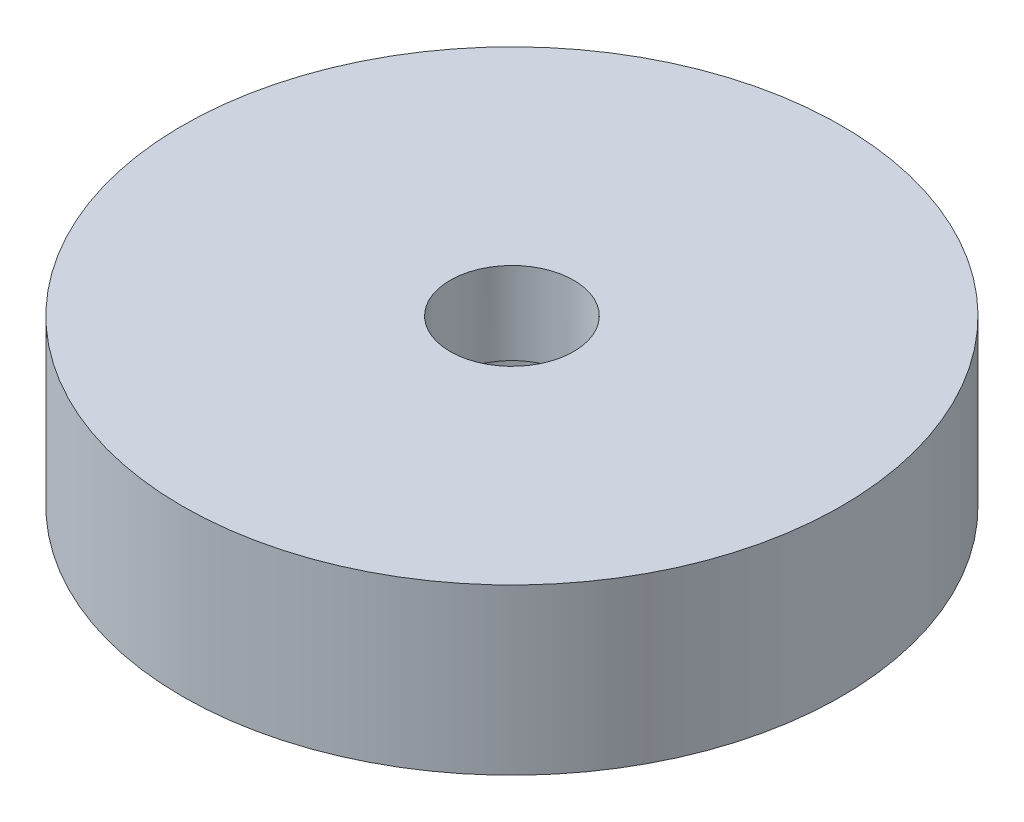
from build123d import *

# Parameters (mm, degrees)
SKETCH1_R           = 25.4
BOSS_EXTRUDE1_DEPTH = 12.7
SKETCH2_R           = 4.7625
CUT_EXTRUDE1_DEPTH  = 12.7
SKETCH4_R           = 9.525
CUT_EXTRUDE3_DEPTH  = 6.35


with BuildPart() as part:
    # Sketch1 → Boss-Extrude1 (new body)
    with BuildSketch(Plane(origin=(0, 0, 0), x_dir=(1, 0, 0), z_dir=(0, 1, 0))):
        with Locations(Location((0, 0, 0), (0, 0, 270))):
            Circle(SKETCH1_R)
    extrude(amount=BOSS_EXTRUDE1_DEPTH)

    # Sketch2 → Cut-Extrude1 (cut)
    with BuildSketch(Plane(origin=(0, 12.7, 0), x_dir=(1, 0, 0), z_dir=(0, 1, 0))):
        with Locations(Location((0, 0, 0), (0, 0, 270))):
            Circle(SKETCH2_R)
    extrude(amount=-CUT_EXTRUDE1_DEPTH, mode=Mode.SUBTRACT)

    # Sketch4 → Cut-Extrude3 (cut)
    with BuildSketch(Plane(origin=(0, 0, 0), x_dir=(-1, 0, 0), z_dir=(0, -1, 0))):
        with Locations(Location((0, 0, 0), (0, 0, 90))):
            Circle(SKETCH4_R)
    extrude(amount=-CUT_EXTRUDE3_DEPTH, mode=Mode.SUBTRACT)


solid = part.part
